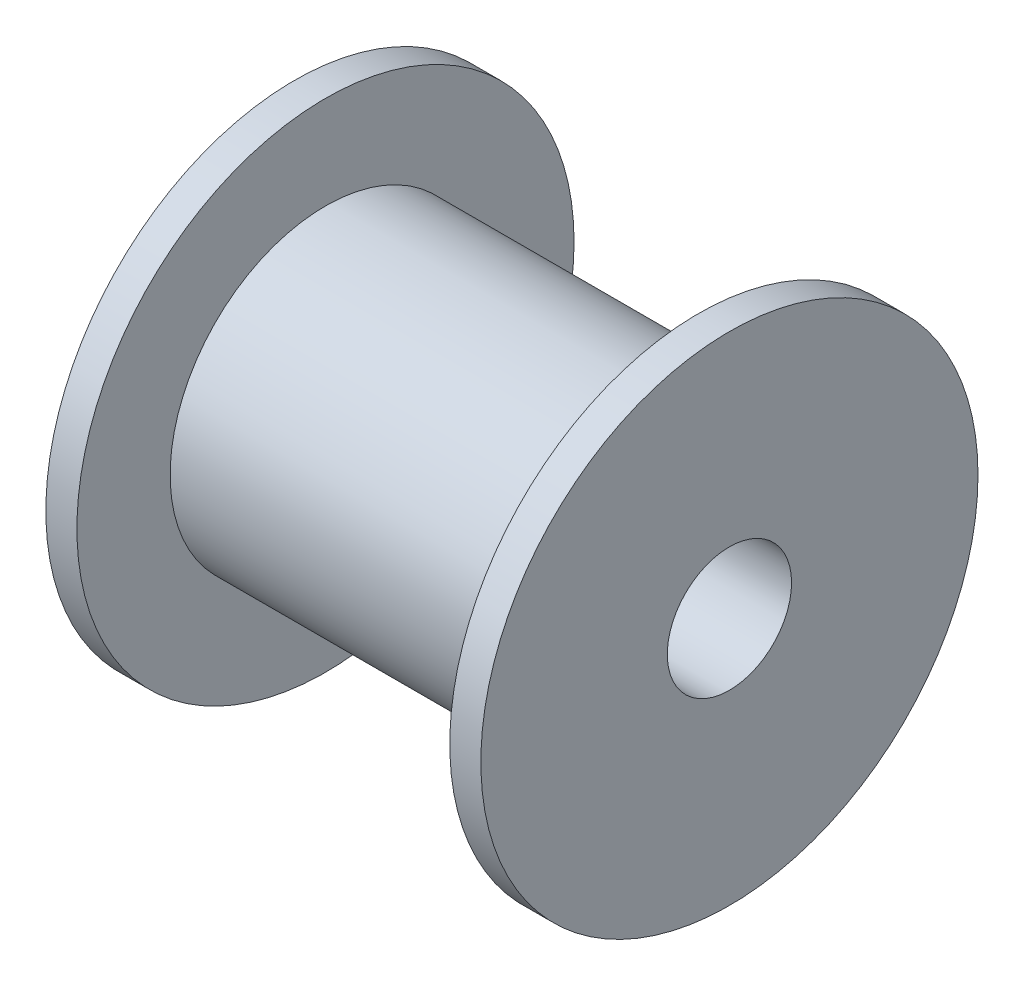
from build123d import *

# Parameters (mm, degrees)
SKETCH1_R               = 12.5
SKETCH1_R_2             = 5
BOSS_EXTRUDE1_DEPTH     = 15
SKETCH2_R               = 20
BOSS_EXTRUDE2_DEPTH     = 2.5
CUT_EXTRUDE1_DEPTH      = 46
CUT_EXTRUDE1_DEPTH_BACK = 46
SKETCH3_R               = 5


with BuildPart() as part:
    # Sketch1 → Boss-Extrude1 (new, symmetric)
    with BuildSketch(Plane(origin=(0, 0, 0), x_dir=(0, 0, -1), z_dir=(1, 0, 0))):
        Circle(SKETCH1_R)
        Circle(SKETCH1_R_2, mode=Mode.SUBTRACT)
    extrude(amount=BOSS_EXTRUDE1_DEPTH, both=True)

    # Sketch2 → Boss-Extrude2 (add)
    with BuildSketch(Plane(origin=(15, 0, 0), x_dir=(0, 0, -1), z_dir=(1, 0, 0))):
        Circle(SKETCH2_R)
    boss_extrude2 = extrude(amount=BOSS_EXTRUDE2_DEPTH)

    # Mirror1: Boss-Extrude2 across plane
    add(boss_extrude2.mirror(Plane(origin=(0, 0, 0), x_dir=(0, 0, 1), z_dir=(1, 0, 0))))

    # Sketch3 → Cut-Extrude1 (cut, two sides: drawn at the far end of the back side and taken through both)
    with BuildSketch(Plane(origin=(17.5, 0, 0), x_dir=(0, 0, -1), z_dir=(1, 0, 0)).offset(-CUT_EXTRUDE1_DEPTH_BACK)):
        Circle(SKETCH3_R)
    extrude(amount=CUT_EXTRUDE1_DEPTH + CUT_EXTRUDE1_DEPTH_BACK, mode=Mode.SUBTRACT)


solid = part.part
